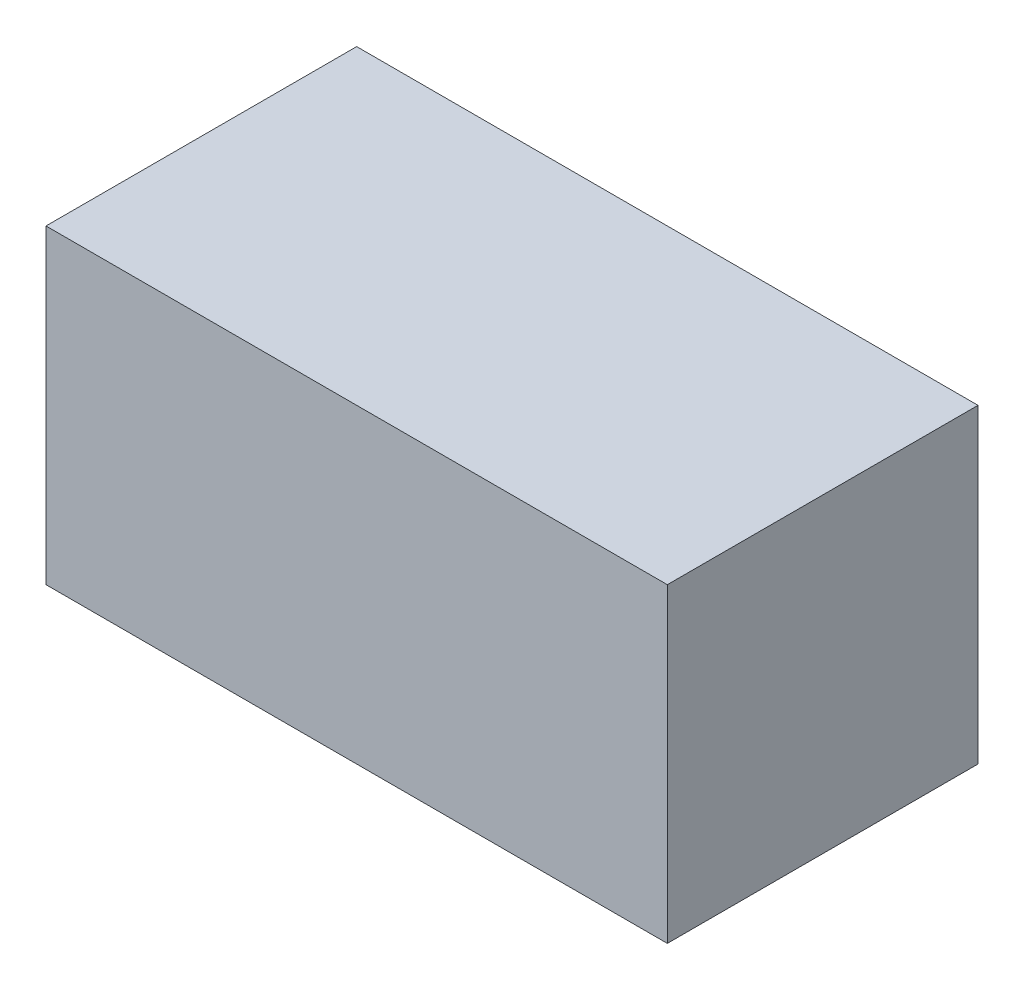
from build123d import *

# Parameters (mm, degrees)
SKETCH1_W           = 10
SKETCH1_H           = 5
BOSS_EXTRUDE1_DEPTH = 5


with BuildPart() as part:
    # Sketch1 → Boss-Extrude1 (new body)
    with BuildSketch(Plane.XY):
        with Locations((5, 2.5)):
            Rectangle(SKETCH1_W, SKETCH1_H)
    extrude(amount=BOSS_EXTRUDE1_DEPTH)


solid = part.part
